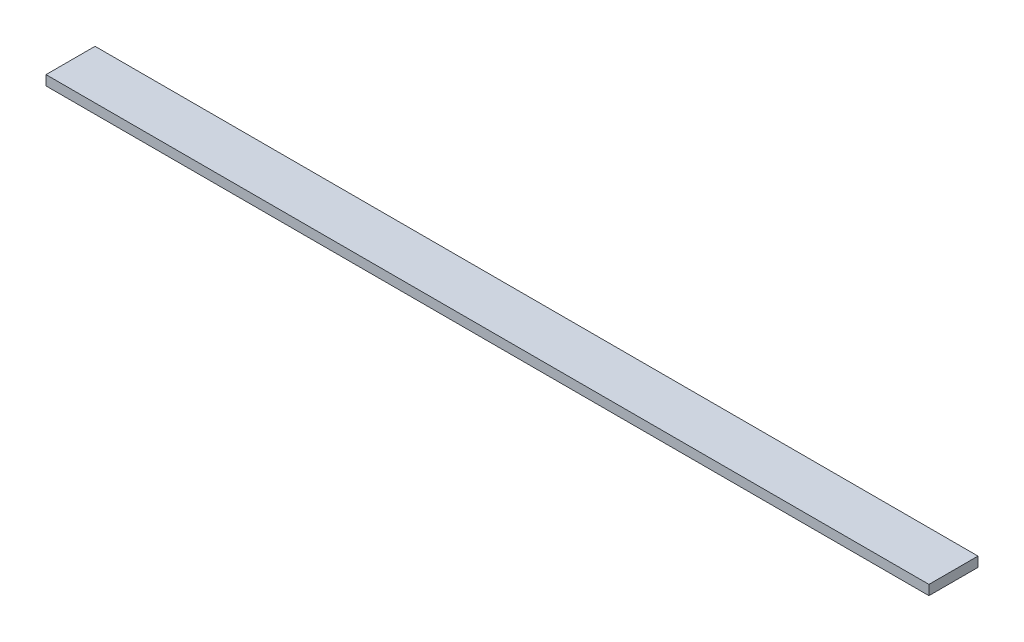
from build123d import *

# Parameters (mm, degrees)
SKETCH1_W           = 381
SKETCH1_H           = 381
BOSS_EXTRUDE1_DEPTH = 25.4
FILLET1_R           = 25.4
BOSS_EXTRUDE2_START = 127
BOSS_EXTRUDE2_DEPTH = 127
FILLET5_R           = 2.54
FILLET6_R           = 2.54
SKETCH3_W           = 381
SKETCH3_H           = 45.536829563
BOSS_EXTRUDE3_DEPTH = 127
CUT_EXTRUDE1_START  = -127
CUT_EXTRUDE1_DEPTH  = 127
CUT_EXTRUDE2_START  = -127
CUT_EXTRUDE2_DEPTH  = 127
SKETCH7_W           = 159.592910526
SKETCH7_H           = 279.668363548
CUT_EXTRUDE3_DEPTH  = 540.805557869
CUT_EXTRUDE4_DEPTH  = 121.92
SKETCH10_W          = 12.830407975
SKETCH10_H          = 5.381034355
SKETCH10_W_2        = 12.189915085
SKETCH10_H_2        = 7.553204363
BOSS_EXTRUDE4_DEPTH = 5.08
SKETCH12_W          = 381
SKETCH12_H          = 5.08
BOSS_EXTRUDE5_DEPTH = 5.842
SKETCH14_W          = 25.4
SKETCH14_H          = 25.4
BOSS_EXTRUDE6_DEPTH = 5.08
SKETCH15_W          = 381
SKETCH15_H          = 25.4
BOSS_EXTRUDE7_DEPTH = 2.54
SKETCH18_W          = 25.978829563
SKETCH18_H          = 5.08
CUT_EXTRUDE6_DEPTH  = 463.44511455
SKETCH19_W          = 25.4
SKETCH19_H          = 2.54
CUT_EXTRUDE7_DEPTH  = 463.44511455
SKETCH21_W          = 76.2
SKETCH21_H          = 25.4
BOSS_EXTRUDE8_DEPTH = 5.08


with BuildPart() as part:
    # Sketch1 → Boss-Extrude1 (new body)
    with BuildSketch(Plane(origin=(0, 0, 0), x_dir=(1, 0, 0), z_dir=(0, 1, 0))):
        with Locations((-70.583665339, -17.076693227)):
            Rectangle(SKETCH1_W, SKETCH1_H)
    extrude(amount=BOSS_EXTRUDE1_DEPTH)

    # Fillet1
    fillet1_edges = [part.edges().sort_by_distance(p)[0] for p in [
        (-261.083665339, 12.7, -173.423306773),
        (119.916334661, 12.7, -173.423306773),
        (119.916334661, 12.7, 207.576693227),
        (-261.083665339, 12.7, 207.576693227),
    ]]
    fillet(fillet1_edges, radius=FILLET1_R)

    # Sketch2 → Boss-Extrude2 (add)
    with BuildSketch(Plane(origin=(0, 25.4, 0), x_dir=(1, 0, 0), z_dir=(0, 1, 0)).offset(BOSS_EXTRUDE2_START)):
        with BuildLine():
            ThreePointArc((94.516334661, -207.576693227), (112.476846903, -200.137205469), (119.916334661, -182.176693227))
            Line((119.916334661, -182.176693227), (119.916334661, -162.77058906))
            ThreePointArc((119.916334661, -162.77058906), (115.157902312, -162.131654008), (110.356896004, -162.096230085))
            Line((110.356896004, -162.096230085), (110.356896004, -169.819933243))
            ThreePointArc((110.356896004, -169.819933243), (110.63661406, -173.531591416), (110.356896004, -177.243249589))
            ThreePointArc((110.356896004, -177.243249589), (103.383001842, -191.043360408), (89.582891024, -198.017254569))
            ThreePointArc((89.582891024, -198.017254569), (85.871232851, -198.296972625), (82.159574678, -198.017254569))
            Line((82.159574678, -198.017254569), (74.435871519, -198.017254569))
            ThreePointArc((74.435871519, -198.017254569), (74.471295442, -202.818260878), (75.110230494, -207.576693227))
            Line((75.110230494, -207.576693227), (94.516334661, -207.576693227))
        make_face()
        with BuildLine():
            ThreePointArc((110.356896004, 127.942843631), (115.157902312, 127.978267553), (119.916334661, 128.617202605))
            Line((119.916334661, 128.617202605), (119.916334661, 148.023306773))
            ThreePointArc((119.916334661, 148.023306773), (112.476846903, 165.983819015), (94.516334661, 173.423306773))
            Line((94.516334661, 173.423306773), (75.110230494, 173.423306773))
            ThreePointArc((75.110230494, 173.423306773), (74.471295442, 168.664874423), (74.435871519, 163.863868115))
            Line((74.435871519, 163.863868115), (82.159574678, 163.863868115))
            ThreePointArc((82.159574678, 163.863868115), (85.871232851, 164.143586171), (89.582891024, 163.863868115))
            ThreePointArc((89.582891024, 163.863868115), (103.383001842, 156.889973954), (110.356896004, 143.089863135))
            ThreePointArc((110.356896004, 143.089863135), (110.63661406, 139.378204962), (110.356896004, 135.666546789))
            Line((110.356896004, 135.666546789), (110.356896004, 127.942843631))
        make_face()
        with BuildLine():
            Line((-235.683665339, -207.576693227), (-216.277561171, -207.576693227))
            ThreePointArc((-216.277561171, -207.576693227), (-215.638626119, -202.818260878), (-215.603202197, -198.017254569))
            Line((-215.603202197, -198.017254569), (-223.326905355, -198.017254569))
            ThreePointArc((-223.326905355, -198.017254569), (-227.038563528, -198.296972625), (-230.750221701, -198.017254569))
            ThreePointArc((-230.750221701, -198.017254569), (-244.55033252, -191.043360408), (-251.524226681, -177.243249589))
            ThreePointArc((-251.524226681, -177.243249589), (-251.803944737, -173.531591416), (-251.524226681, -169.819933243))
            Line((-251.524226681, -169.819933243), (-251.524226681, -162.096230085))
            ThreePointArc((-251.524226681, -162.096230085), (-256.325232989, -162.131654008), (-261.083665339, -162.77058906))
            Line((-261.083665339, -162.77058906), (-261.083665339, -182.176693227))
            ThreePointArc((-261.083665339, -182.176693227), (-253.644177581, -200.137205469), (-235.683665339, -207.576693227))
        make_face()
        with BuildLine():
            ThreePointArc((-215.603202197, 163.863868115), (-215.638626119, 168.664874423), (-216.277561171, 173.423306773))
            Line((-216.277561171, 173.423306773), (-235.683665339, 173.423306773))
            ThreePointArc((-235.683665339, 173.423306773), (-253.644177581, 165.983819015), (-261.083665339, 148.023306773))
            Line((-261.083665339, 148.023306773), (-261.083665339, 128.617202605))
            ThreePointArc((-261.083665339, 128.617202605), (-256.325232989, 127.978267553), (-251.524226681, 127.942843631))
            Line((-251.524226681, 127.942843631), (-251.524226681, 135.666546789))
            ThreePointArc((-251.524226681, 135.666546789), (-251.803944737, 139.378204962), (-251.524226681, 143.089863135))
            ThreePointArc((-251.524226681, 143.089863135), (-244.55033252, 156.889973954), (-230.750221701, 163.863868115))
            ThreePointArc((-230.750221701, 163.863868115), (-227.038563528, 164.143586171), (-223.326905355, 163.863868115))
            Line((-223.326905355, 163.863868115), (-215.603202197, 163.863868115))
        make_face()
    extrude(amount=-BOSS_EXTRUDE2_DEPTH)

    # Fillet5
    fillet5_edges = [part.edges().sort_by_distance(p)[0] for p in [
        (74.435871519, 88.9, -163.863868115),
        (110.356896004, 88.9, -127.942843631),
        (119.916334661, 88.9, -128.617202605),
        (75.110230494, 88.9, -173.423306773),
    ]]
    fillet(fillet5_edges, radius=FILLET5_R)

    # Fillet6
    fillet6_edges = [part.edges().sort_by_distance(p)[0] for p in [
        (-215.603202197, 88.9, -163.863868115),
        (-216.277561171, 88.9, -173.423306773),
        (-261.083665339, 88.9, -128.617202605),
        (-251.524226681, 88.9, -127.942843631),
        (74.435871519, 88.9, 198.017254569),
        (75.110230494, 88.9, 207.576693227),
        (119.916334661, 88.9, 162.77058906),
        (110.356896004, 88.9, 162.096230085),
        (-216.277561171, 88.9, 207.576693227),
        (-215.603202197, 88.9, 198.017254569),
        (-251.524226681, 88.9, 162.096230085),
        (-261.083665339, 88.9, 162.77058906),
    ]]
    fillet(fillet6_edges, radius=FILLET6_R)

    # Sketch3 → Boss-Extrude3 (add)
    with BuildSketch(Plane(origin=(0, 152.4, 0), x_dir=(1, 0, 0), z_dir=(0, 1, 0))):
        with Locations((-70.583665339, -184.808278446)):
            Rectangle(SKETCH3_W, SKETCH3_H)
    extrude(amount=BOSS_EXTRUDE3_DEPTH)

    # Sketch5 → Cut-Extrude1 (cut)
    with BuildSketch(Plane.XZ.offset(-152.4).offset(CUT_EXTRUDE1_START)):
        with BuildLine():
            Line((-261.083665339, 162.039863664), (-261.083665339, 164.916350572))
            ThreePointArc((-261.083665339, 164.916350572), (-260.459455915, 163.248613642), (-258.89362875, 162.400575222))
            ThreePointArc((-258.89362875, 162.400575222), (-256.499630965, 162.144358959), (-254.094230188, 162.039863664))
            Line((-254.094230188, 162.039863664), (-261.083665339, 162.039863664))
        make_face()
        with BuildLine():
            Line((-261.083665339, 207.576693227), (-235.683665339, 207.576693227))
            ThreePointArc((-235.683665339, 207.576693227), (-253.644177581, 200.137205469), (-261.083665339, 182.176693227))
            Line((-261.083665339, 182.176693227), (-261.083665339, 207.576693227))
        make_face()
    extrude(amount=CUT_EXTRUDE1_DEPTH, mode=Mode.SUBTRACT)

    # Sketch6 → Cut-Extrude2 (cut)
    with BuildSketch(Plane.XZ.offset(-152.4).offset(CUT_EXTRUDE2_START)):
        with BuildLine():
            Line((119.916334661, 162.039863664), (112.926899511, 162.039863664))
            ThreePointArc((112.926899511, 162.039863664), (115.332300288, 162.144358959), (117.726298073, 162.400575222))
            ThreePointArc((117.726298073, 162.400575222), (119.292125238, 163.248613642), (119.916334661, 164.916350572))
            Line((119.916334661, 164.916350572), (119.916334661, 162.039863664))
        make_face()
        with BuildLine():
            Line((119.916334661, 207.576693227), (119.916334661, 182.176693227))
            ThreePointArc((119.916334661, 182.176693227), (112.476846903, 200.137205469), (94.516334661, 207.576693227))
            Line((94.516334661, 207.576693227), (119.916334661, 207.576693227))
        make_face()
    extrude(amount=CUT_EXTRUDE2_DEPTH, mode=Mode.SUBTRACT)

    # Sketch7 → Cut-Extrude3 (cut, through all)
    with BuildSketch(Plane.XY.offset(207.576693227)):
        with Locations((-277.192611624, 12.565818226)):
            Rectangle(SKETCH7_W, SKETCH7_H)
        Polygon((188.205407311, 152.4), (-197.396156361, 152.4), (-197.396156361, -127.268363548), (-197.396156361, -138.930106511), (188.205407311, -138.930106511), align=None)
    extrude(amount=-CUT_EXTRUDE3_DEPTH, mode=Mode.SUBTRACT)

    # Sketch9 → Cut-Extrude4 (cut)
    with BuildSketch(Plane(origin=(0, 279.4, 0), x_dir=(1, 0, 0), z_dir=(0, 1, 0))):
        with BuildLine():
            Line((112.926899511, -162.039863664), (-254.094230188, -162.039863664))
            ThreePointArc((-254.094230188, -162.039863664), (-256.499630965, -162.144358959), (-258.89362875, -162.400575222))
            ThreePointArc((-258.89362875, -162.400575222), (-260.459455915, -163.248613642), (-261.083665339, -164.916350572))
            Line((-261.083665339, -164.916350572), (-261.083665339, -182.176693227))
            ThreePointArc((-261.083665339, -182.176693227), (-253.644177581, -200.137205469), (-235.683665339, -207.576693227))
            Line((-235.683665339, -207.576693227), (94.516334661, -207.576693227))
            ThreePointArc((94.516334661, -207.576693227), (112.476846903, -200.137205469), (119.916334661, -182.176693227))
            Line((119.916334661, -182.176693227), (119.916334661, -164.916350572))
            ThreePointArc((119.916334661, -164.916350572), (119.292125238, -163.248613642), (117.726298073, -162.400575222))
            ThreePointArc((117.726298073, -162.400575222), (115.332300288, -162.144358959), (112.926899511, -162.039863664))
        make_face()
    extrude(amount=-CUT_EXTRUDE4_DEPTH, mode=Mode.SUBTRACT)

    # Sketch10 → Boss-Extrude4 (add)
    with BuildSketch(Plane(origin=(0, 157.48, 0), x_dir=(1, 0, 0), z_dir=(0, 1, 0))):
        with Locations((-254.668461352, -164.730380842)):
            Rectangle(SKETCH10_W, SKETCH10_H)
        with Locations((113.821377119, -165.816465846)):
            Rectangle(SKETCH10_W_2, SKETCH10_H_2)
    extrude(amount=-BOSS_EXTRUDE4_DEPTH)

    # Sketch12 → Boss-Extrude5 (add)
    with BuildSketch(Plane(origin=(0, 0, 162.039863664), x_dir=(-1, 0, 0), z_dir=(0, 0, -1))):
        with Locations((70.583665339, 154.94)):
            Rectangle(SKETCH12_W, SKETCH12_H)
    extrude(amount=BOSS_EXTRUDE5_DEPTH)

    # Sketch14 → Boss-Extrude6 (add)
    with BuildSketch(Plane(origin=(0, 157.48, 0), x_dir=(1, 0, 0), z_dir=(0, 1, 0))):
        with Locations((107.216334661, -194.876693227)):
            Rectangle(SKETCH14_W, SKETCH14_H)
        with Locations((-248.383665339, -194.876693227)):
            Rectangle(SKETCH14_W, SKETCH14_H)
    extrude(amount=-BOSS_EXTRUDE6_DEPTH)

    # Sketch15 → Boss-Extrude7 (add)
    with BuildSketch(Plane(origin=(0, 157.48, 0), x_dir=(1, 0, 0), z_dir=(0, 1, 0))):
        with Locations((-70.583665339, -194.876693227)):
            Rectangle(SKETCH15_W, SKETCH15_H)
    extrude(amount=BOSS_EXTRUDE7_DEPTH)

    # Sketch18 → Cut-Extrude6 (cut, through all)
    with BuildSketch(Plane.ZY.offset(261.083665339)):
        with Locations((169.187278445, 154.94)):
            Rectangle(SKETCH18_W, SKETCH18_H)
    extrude(amount=-CUT_EXTRUDE6_DEPTH, mode=Mode.SUBTRACT)

    # Sketch19 → Cut-Extrude7 (cut, through all)
    with BuildSketch(Plane.ZY.offset(261.083665339)):
        with Locations((194.876693227, 153.67)):
            Rectangle(SKETCH19_W, SKETCH19_H)
    extrude(amount=-CUT_EXTRUDE7_DEPTH, mode=Mode.SUBTRACT)

    # Sketch21 → Boss-Extrude8 (add)
    with BuildSketch(Plane(origin=(0, 160.02, 0), x_dir=(1, 0, 0), z_dir=(0, 1, 0))):
        with Locations((-299.183665339, -194.876693227)):
            Rectangle(SKETCH21_W, SKETCH21_H)
    extrude(amount=-BOSS_EXTRUDE8_DEPTH)


solid = part.part
